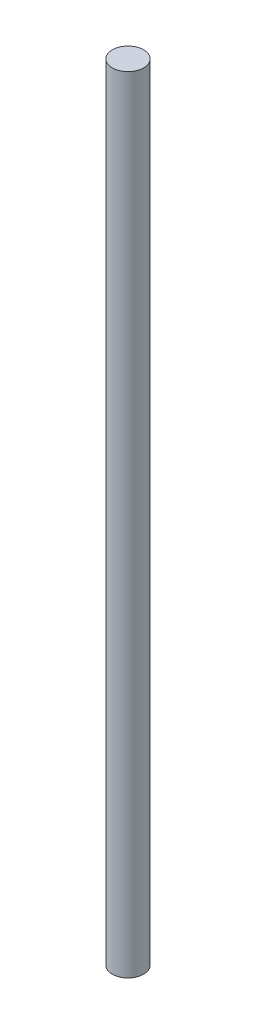
from build123d import *

# Parameters (mm, degrees)
SKETCH1_R           = 20
BOSS_EXTRUDE2_DEPTH = 1000


with BuildPart() as part:
    # Sketch1 → Boss-Extrude2 (new body)
    with BuildSketch(Plane(origin=(0, 0, 0), x_dir=(1, 0, 0), z_dir=(0, 1, 0))):
        with Locations(Location((0, 0, 0), (0, 0, 270))):
            Circle(SKETCH1_R)
    extrude(amount=BOSS_EXTRUDE2_DEPTH)


solid = part.part
